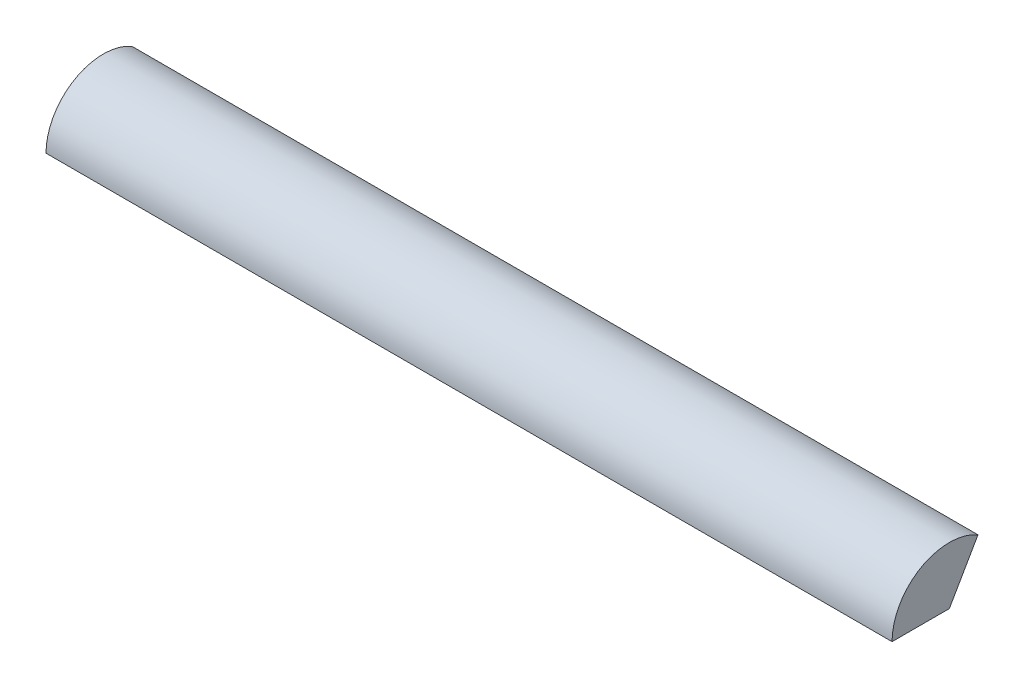
from build123d import *

# Parameters (mm, degrees)
REVOLVE1_ANGLE = 120


with BuildPart() as part:
    # Sketch1 → Revolve1 (revolve)
    with BuildSketch(Plane(origin=(0, 0, 0), x_dir=(1, 0, 0), z_dir=(0, 1, 0))):
        Polygon((0, -41.275), (0, 0), (-20.7, 0), (-20.7, -5), (-170.7, -27.5), (-520.7, -27.5), (-596.9, -27.5), (-596.9, 0), (-609.6, 0), (-609.6, -41.275), align=None)
        with BuildLine():
            Line((-596.9, -27.5), (-520.7, -27.5))
            add(Edge.make_bspline(
                [(-520.7, -27.5), (-596.9, -27.5), (-596.9, 0)],
                knots=[0, 0, 0, 1, 1, 1], degree=2))
            Line((-596.9, 0), (-596.9, -27.5))
        make_face()
    revolve(axis=Axis((0, 0, 0), (-1, 0, 0)), revolution_arc=REVOLVE1_ANGLE)


solid = part.part
